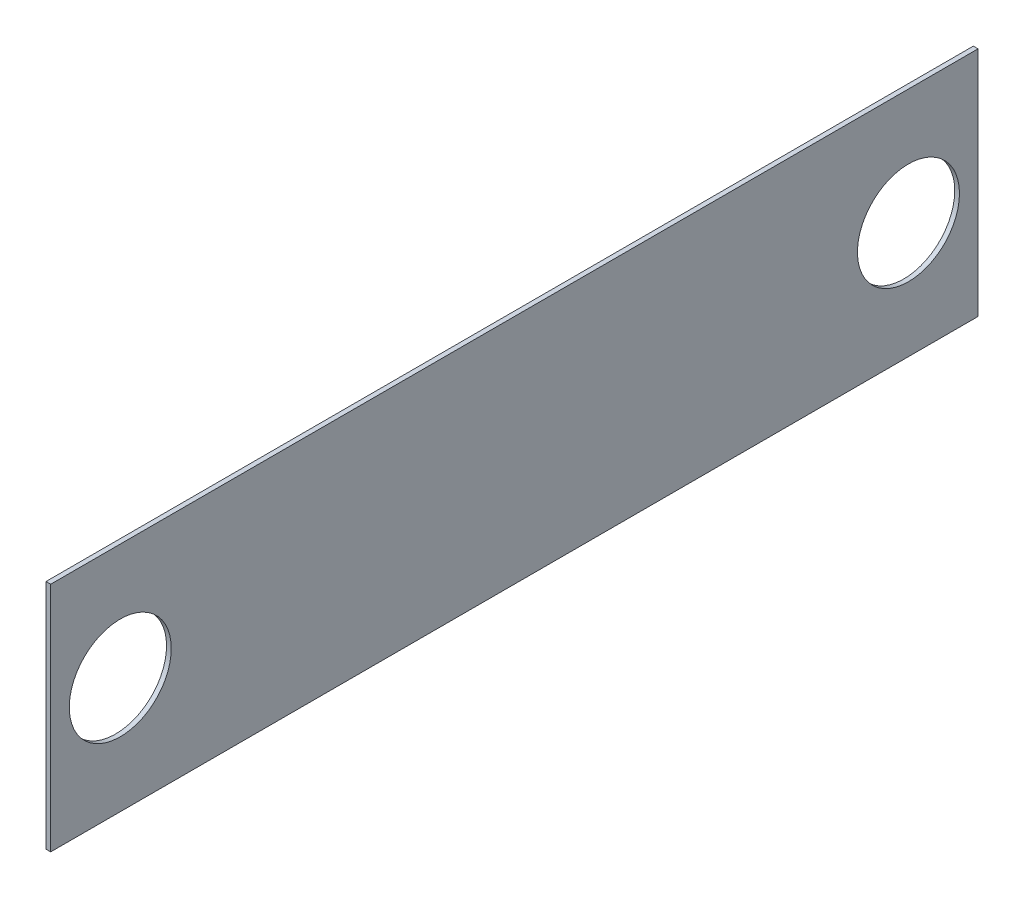
from build123d import *

# Parameters (mm, degrees)
SKETCH1_W             = 100
SKETCH1_H             = 25
BOSS_EXTRUDE1_DEPTH   = 0.508
M10_CLEARANCE_HOLE1_D = 11


with BuildPart() as part:
    # Sketch1 → Boss-Extrude1 (new body)
    with BuildSketch(Plane(origin=(0, 0, 0), x_dir=(0, 0, -1), z_dir=(1, 0, 0))):
        Rectangle(SKETCH1_W, SKETCH1_H)
    extrude(amount=BOSS_EXTRUDE1_DEPTH)

    # M10 Clearance Hole1 (through all)
    with Locations(Plane(origin=(0.508, 0, 0), x_dir=(0, 0, -1), z_dir=(1, 0, 0))):
        with Locations((-42.5, 0), (42.5, 0)):
            Hole(M10_CLEARANCE_HOLE1_D / 2)


solid = part.part
